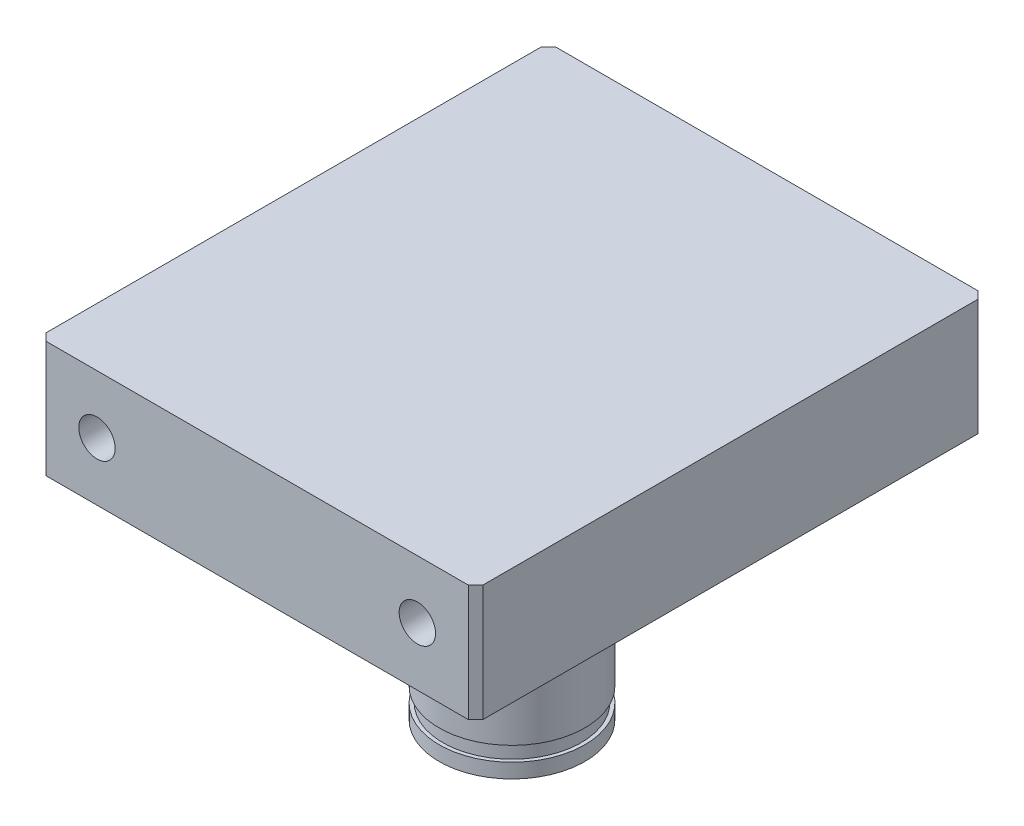
from build123d import *

# Parameters (mm, degrees)
SKETCH_1_W                  = 30
SKETCH_1_H                  = 35
EXTRUDE_1_DEPTH             = 10
CHAMFER_1_SIZE              = 0.5
SKETCH_7_W                  = 31.194113832
SKETCH_7_H                  = 36.870983812
CUT_EXTRUDE_4_DEPTH         = 1
SKETCH_8_R                  = 5
EXTRUDE_2_DEPTH             = 16
SKETCH_9_R                  = 8.5
SKETCH_9_R_2                = 5
EXTRUDE_3_DEPTH             = 4
SKETCH_10_R                 = 7.5
SKETCH_10_R_2               = 5
EXTRUDE_4_DEPTH             = 2
SKETCH_11_R                 = 5
SKETCH_11_R_2               = 4.75
CUT_EXTRUDE_5_DEPTH         = 1
HOLE_WIZARD_M3_1_AT_2_COUNT = 2
HOLE_WIZARD_M3_1_AT_2_PITCH = 22
SKETCH_13_W                 = 30
SKETCH_13_H                 = 1
CUT_EXTRUDE_6_DEPTH         = 41.926763859


with BuildPart() as part:
    # 草图1 → 凸台-拉伸1 (new body)
    with BuildSketch(Plane(origin=(0, 0, 0), x_dir=(1, 0, 0), z_dir=(0, 1, 0))):
        Rectangle(SKETCH_1_W, SKETCH_1_H)
    extrude(amount=EXTRUDE_1_DEPTH)

    # 倒角1
    chamfer_1_edges = [part.edges().sort_by_distance(p)[0] for p in [
        (15, 5, 17.5),
        (-15, 5, 17.5),
        (-15, 5, -17.5),
        (15, 5, -17.5),
    ]]
    chamfer(chamfer_1_edges, length=CHAMFER_1_SIZE)

    # 草图7 → 切除-拉伸4 (cut)
    with BuildSketch(Plane.XZ):
        Rectangle(SKETCH_7_W, SKETCH_7_H)
    extrude(amount=-CUT_EXTRUDE_4_DEPTH, mode=Mode.SUBTRACT)

    # 草图8 → 凸台-拉伸2 (add)
    with BuildSketch(Plane.XZ.offset(-1)):
        with Locations(Location((0, 0, 0), (0, 0, 270))):
            Circle(SKETCH_8_R)
    extrude(amount=EXTRUDE_2_DEPTH)

    # 草图9 → 凸台-拉伸3 (add)
    with BuildSketch(Plane.XZ.offset(-1)):
        with Locations(Location((0, 0, 0), (0, 0, 270))):
            Circle(SKETCH_9_R)
        with Locations(Location((0, 0, 0), (0, 0, 270))):
            Circle(SKETCH_9_R_2, mode=Mode.SUBTRACT)
    extrude(amount=EXTRUDE_3_DEPTH)

    # 草图10 → 凸台-拉伸4 (add)
    with BuildSketch(Plane.XZ.offset(3)):
        with Locations(Location((0, 0, 0), (0, 0, 270))):
            Circle(SKETCH_10_R)
        with Locations(Location((0, 0, 0), (0, 0, 270))):
            Circle(SKETCH_10_R_2, mode=Mode.SUBTRACT)
    extrude(amount=EXTRUDE_4_DEPTH)

    # 草图11 → 切除-拉伸5 (cut)
    with BuildSketch(Plane(origin=(0, -13, 0), x_dir=(-1, 0, 0), z_dir=(0, -1, 0))):
        with Locations(Location((0, 0, 0), (0, 0, 90))):
            Circle(SKETCH_11_R)
        with Locations(Location((0, 0, 0), (0, 0, 90))):
            Circle(SKETCH_11_R_2, mode=Mode.SUBTRACT)
    extrude(amount=CUT_EXTRUDE_5_DEPTH, mode=Mode.SUBTRACT)

    # 草图12 → M3 螺纹孔1 (revolve, cut)
    with BuildSketch(Plane(origin=(11, 5, 17.5), x_dir=(0, -1, 0), z_dir=(1, 0, 0))):
        Polygon((0, 0), (0, 8.751075774), (1.25, 8), (1.25, 0), align=None)
    hole_wizard_m3_1 = revolve(axis=Axis((11, 5, 23.85), (0, 0, -1)), mode=Mode.SUBTRACT)

    # M3 螺纹孔1 at 2: M3 螺纹孔1 ×2
    with Locations(*[(-i * HOLE_WIZARD_M3_1_AT_2_PITCH, 0, 0) for i in range(1, HOLE_WIZARD_M3_1_AT_2_COUNT)]):
        add(hole_wizard_m3_1, mode=Mode.SUBTRACT)

    # 镜向1: M3 螺纹孔1 across plane
    add(hole_wizard_m3_1.mirror(Plane.XY), mode=Mode.SUBTRACT)

    # 镜向1 copy 1 sketch → 镜向1 copy 1 (revolve, cut)
    with BuildSketch(Plane(origin=(-11, 5, -17.5), x_dir=(0, -1, 0), z_dir=(1, 0, 0))):
        Polygon((0, 0), (0, -8.751075774), (1.25, -8), (1.25, 0), align=None)
    revolve(axis=Axis((-11, 5, -23.85), (0, 0, -1)), mode=Mode.SUBTRACT)

    # 草图13 → 切除-拉伸6 (cut, through all)
    with BuildSketch(Plane(origin=(0, 0, -17.5), x_dir=(-1, 0, 0), z_dir=(0, 0, -1))):
        with Locations((0, 9.5)):
            Rectangle(SKETCH_13_W, SKETCH_13_H)
    extrude(amount=-CUT_EXTRUDE_6_DEPTH, mode=Mode.SUBTRACT)


solid = part.part
